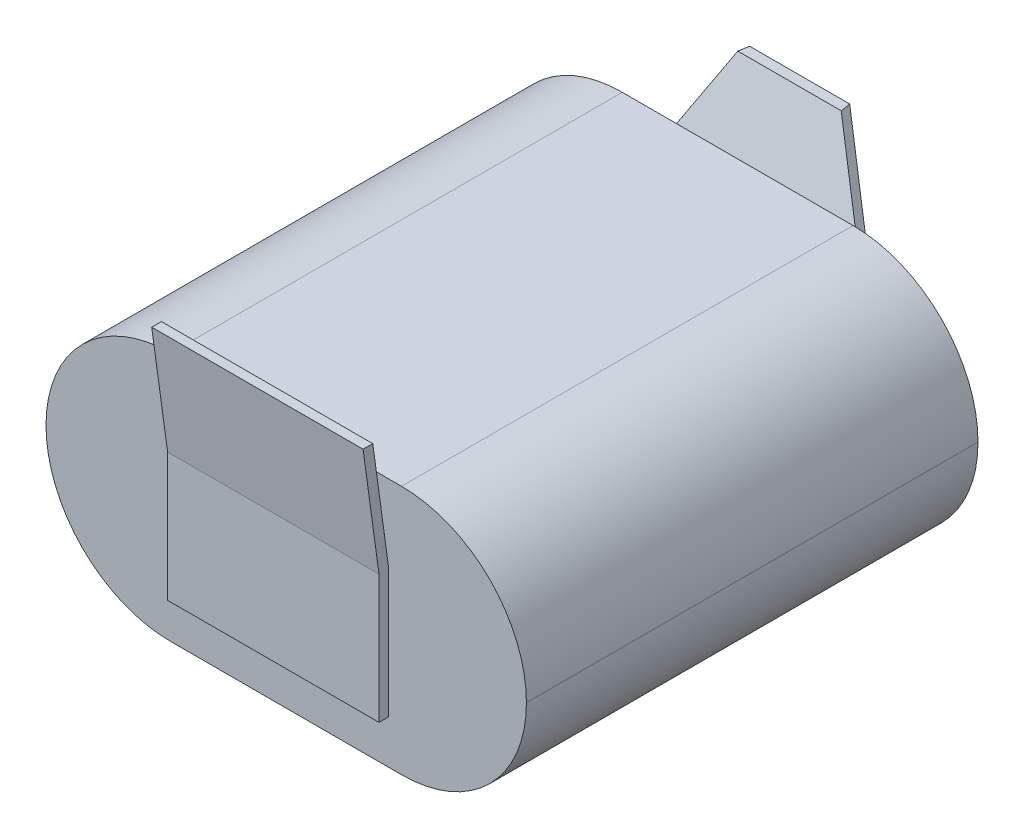
from build123d import *

# Parameters (mm, degrees)
EXTRUSION1_DEPTH        = 23.5
EXTRUSION2_DEPTH        = 5.5
EXTRUSION3_DEPTH        = 5.5
ENL_V_MAT_EXTRU_1_DEPTH = 0.5


with BuildPart() as part:
    # Esquisse1 → Extrusion1 (new body)
    with BuildSketch(Plane.XY):
        with BuildLine():
            Line((-8.839098079, -7.6), (3.170901921, -7.6))
            ThreePointArc((3.170901921, -7.6), (7.767095998, -9.503805922), (9.670901921, -14.1))
            Line((9.670901921, -14.1), (9.670901921, -14.11))
            ThreePointArc((9.670901921, -14.11), (7.770024931, -18.69912301), (3.180901921, -20.6))
            Line((3.180901921, -20.6), (-8.829098079, -20.6))
            ThreePointArc((-8.829098079, -20.6), (-13.425292157, -18.696194078), (-15.329098079, -14.1))
            Line((-15.329098079, -14.1), (-15.329098079, -14.09))
            ThreePointArc((-15.329098079, -14.09), (-13.428221089, -9.50087699), (-8.839098079, -7.6))
        make_face()
    extrude(amount=-EXTRUSION1_DEPTH)

    # Esquisse2 → Extrusion2 (add, symmetric)
    with BuildSketch(Plane(origin=(-3, 0, 0), x_dir=(0, 0, -1), z_dir=(1, 0, 0))):
        Polygon((0, -18.324724565), (0, -11.607872713), (-0.824207274, -5.6), (-1.328890469, -5.6), (-0.5, -11.64200981), (-0.5, -18.324724565), align=None)
    extrude(amount=EXTRUSION2_DEPTH, both=True)

    # Esquisse3 → Extrusion3 (add, symmetric)
    with BuildSketch(Plane(origin=(-3, 0, 0), x_dir=(0, 0, -1), z_dir=(1, 0, 0))):
        Polygon((23.5, -18.324724565), (24, -18.324724565), (24, -14.11), (26.890994991, -5.6), (26.362930623, -5.6), (23.5, -14.027389076), align=None)
    extrude(amount=EXTRUSION3_DEPTH, both=True)

    # Esquisse4 → Enlèv. mat.-Extru.1 (cut)
    with BuildSketch(Plane(origin=(0, -8.769547771, -25.814244494), x_dir=(-1, 0, 0), z_dir=(0, -0.32166286073299966, -0.9468542675750388))):
        Polygon((0.645397002, 3.83477814), (-2.5, -2.321461893), (-3.257578705, -2.321461893), (-3.257578705, 4.719989125), (9.257578705, 4.719989125), (9.257578705, -2.321461893), (8.5, -2.321461893), (5.354602998, 3.83477814), align=None)
    extrude(amount=-ENL_V_MAT_EXTRU_1_DEPTH, mode=Mode.SUBTRACT)


solid = part.part
